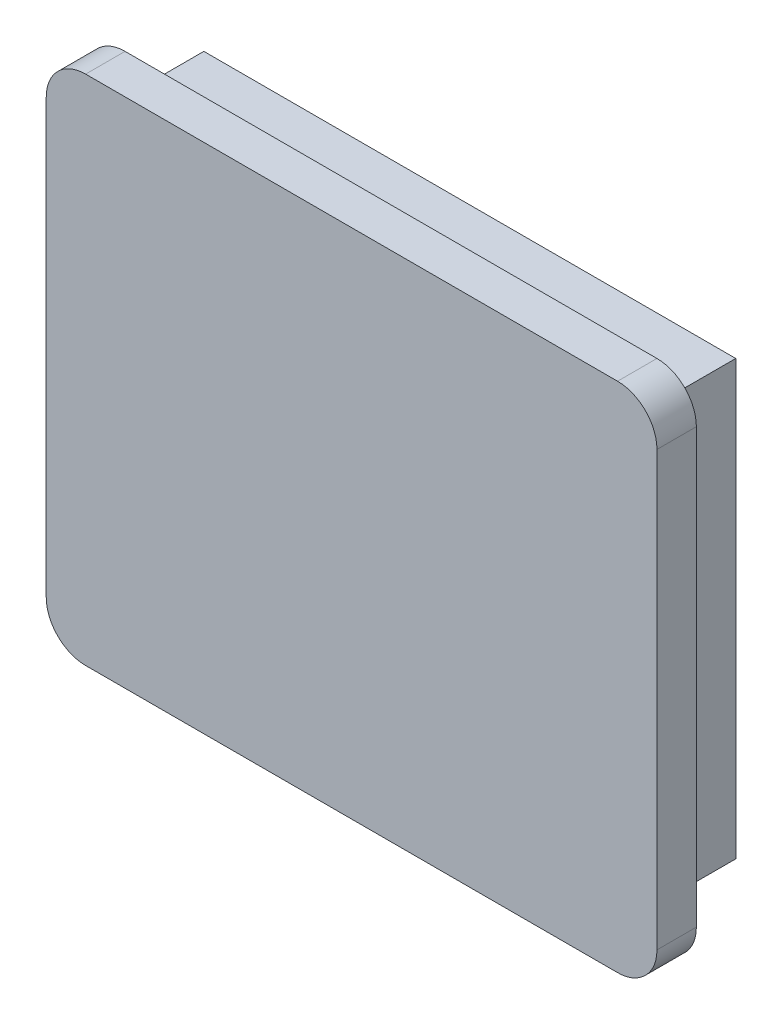
from build123d import *

# Parameters (mm, degrees)
ESQUISSE2_W        = 15.5
ESQUISSE2_H        = 13
BOSS_EXTRU_1_DEPTH = 1
BOSS_EXTRU_2_DEPTH = 2
CONG_1_R           = 1


with BuildPart() as part:
    # Esquisse2 → Boss.-Extru.1 (new body)
    with BuildSketch(Plane.XY):
        Rectangle(ESQUISSE2_W, ESQUISSE2_H)
    extrude(amount=BOSS_EXTRU_1_DEPTH)

    # Esquisse3 → Boss.-Extru.2 (add)
    with BuildSketch(Plane(origin=(0, 0, 0), x_dir=(-1, 0, 0), z_dir=(0, 0, -1))):
        Polygon((5.522727273, -4.5), (6.75, -4.5), (6.75, -5.5), (-6.75, -5.5), (-6.75, 5.5), (6.75, 5.5), (6.75, 4.5), (5.522727273, 4.5), (-5.522727273, 4.5), (-5.522727273, -4.5), align=None)
    extrude(amount=BOSS_EXTRU_2_DEPTH)

    # Congé1
    cong_1_edges = [part.edges().sort_by_distance(p)[0] for p in [
        (-7.75, 6.5, 0.5),
        (7.75, 6.5, 0.5),
        (7.75, -6.5, 0.5),
        (-7.75, -6.5, 0.5),
    ]]
    fillet(cong_1_edges, radius=CONG_1_R)


solid = part.part
